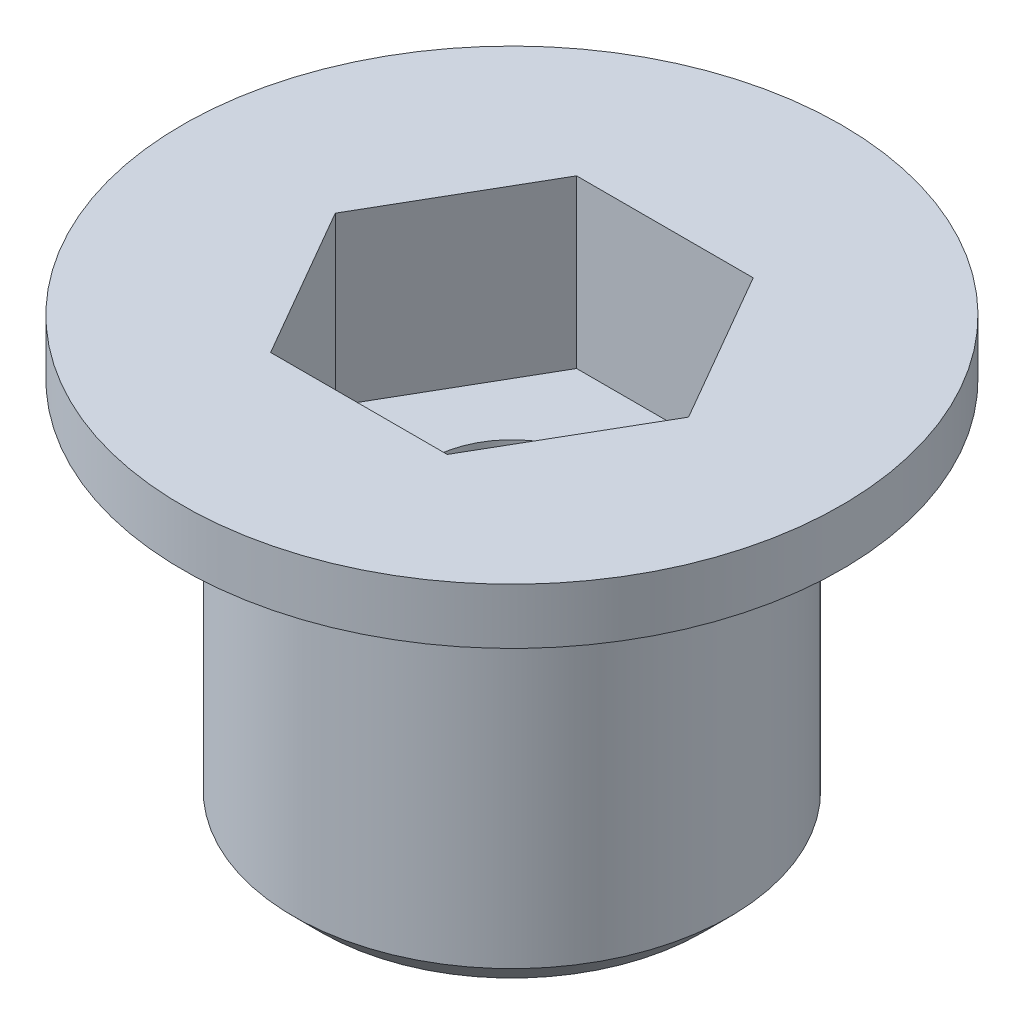
from build123d import *

# Parameters (mm, degrees)
CHANFREIN1_SIZE         = 0.5
ENL_V_MAT_EXTRU_2_DEPTH = 3


with BuildPart() as part:
    # Esquisse1 → Révolution1 (revolve)
    with BuildSketch(Plane.XY, mode=Mode.PRIVATE) as r_volution1_sk:
        Polygon((1.5, 7.9), (5.925, 7.9), (5.925, 6.9), (3.925, 6.9), (3.925, 0), (1.5, 0), align=None)
    revolve(r_volution1_sk.sketch.rotate(Axis((0, 0, 0), (0, 1, 0)), 90), axis=Axis((0, 0, 0), (0, 1, 0)))

    # Chanfrein1
    chanfrein1_edges = [part.edges().sort_by_distance(p)[0] for p in [
        (0, 0, 3.925),
        (0, 6.9, 3.925),
    ]]
    chamfer(chanfrein1_edges, length=CHANFREIN1_SIZE)

    # Esquisse3 → Enlèv. mat.-Extru.2 (cut)
    with BuildSketch(Plane(origin=(0, 7.9, 0), x_dir=(1, 0, 0), z_dir=(0, 1, 0))):
        Polygon((1.58771324, 2.75), (-1.58771324, 2.75), (-3.175426481, 0), (-1.58771324, -2.75), (1.58771324, -2.75), (3.175426481, 0), align=None)
    extrude(amount=-ENL_V_MAT_EXTRU_2_DEPTH, mode=Mode.SUBTRACT)


solid = part.part
